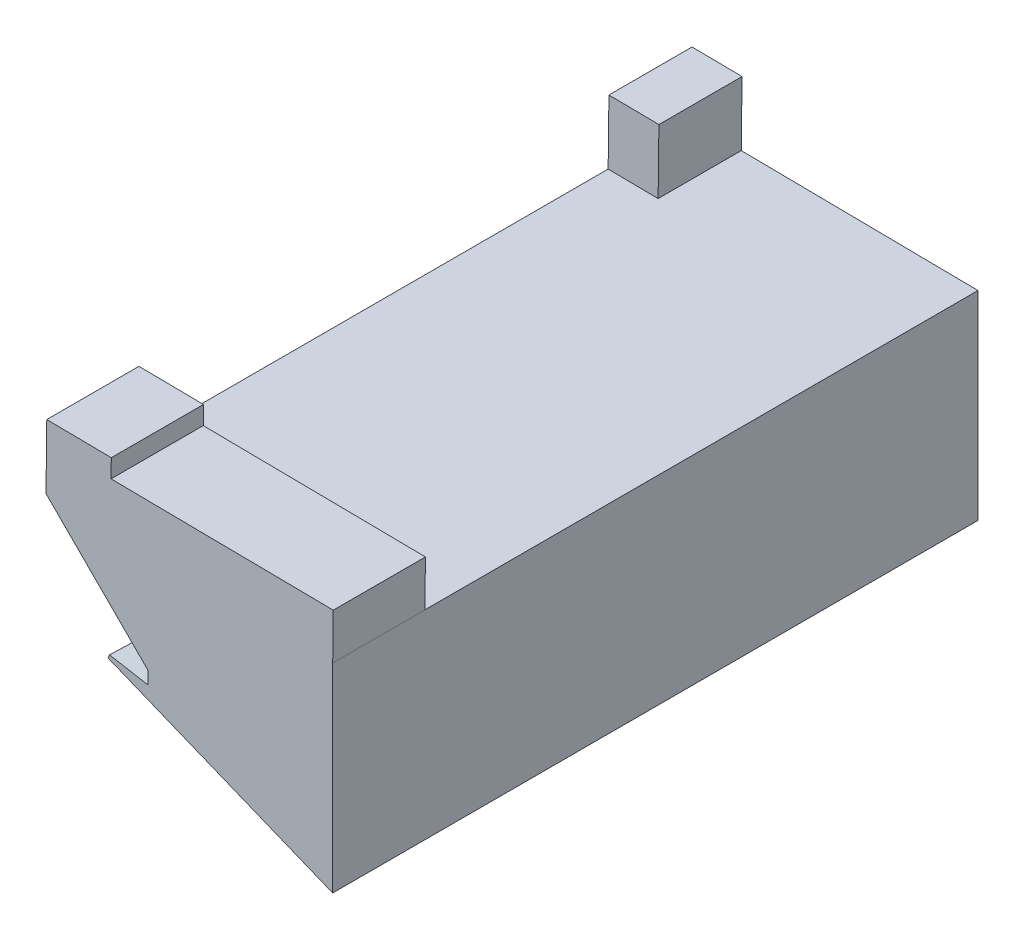
from build123d import *

# Parameters (mm, degrees)
BOSS_EXTRU_1_DEPTH      = 35
ESQUISSE3_W             = 15.551416147
ESQUISSE3_H             = 5
BOSS_EXTRU_3_DEPTH      = 3.5
ESQUISSE4_W             = 14.990100516
ESQUISSE4_H             = 8.543070591
ENL_V_MAT_EXTRU_4_DEPTH = 11
ESQUISSE5_W             = 2.711143337
ESQUISSE5_H             = 4.509933932
BOSS_EXTRU_4_DEPTH      = 3.5
CONG_2_R                = 0.1
ENL_V_MAT_EXTRU_7_DEPTH = 11


with BuildPart() as part:
    # Esquisse1 → Boss.-Extru.1 (new body)
    with BuildSketch(Plane.XY):
        Polygon((0, -0.638190255), (-5.531744574, 4.893554319), (10.018583778, 4.709618574), (10.016881657, -6.092719993), (-3.032142088, -0.792171418), (0, -1.326819878), align=None)
    extrude(amount=BOSS_EXTRU_1_DEPTH)

    # Esquisse3 → Boss.-Extru.3 (add)
    with BuildSketch(Plane(origin=(0.05710105, 4.827447131, 0), x_dir=(0.9999300516333419, -0.011827588111794733, 0), z_dir=(0.011827588111794733, 0.9999300516333419, 0))):
        with Locations((2.186471492, -32.5)):
            Rectangle(ESQUISSE3_W, ESQUISSE3_H)
    extrude(amount=BOSS_EXTRU_3_DEPTH)

    # Esquisse4 → Enlèv. mat.-Extru.4 (cut)
    with BuildSketch(Plane(origin=(0.21677349, 18.326502828, 0), x_dir=(0.9999300516333419, -0.011827588111794735, 0), z_dir=(0.011827588111794735, 0.9999300516333419, 0))):
        with Locations((5.405813676, -32.865617066)):
            Rectangle(ESQUISSE4_W, ESQUISSE4_H)
    extrude(amount=-ENL_V_MAT_EXTRU_4_DEPTH, mode=Mode.SUBTRACT)

    # Esquisse5 → Boss.-Extru.4 (add)
    with BuildSketch(Plane(origin=(0.05710105, 4.827447131, 0), x_dir=(0.9999300516333419, -0.011827588111794733, 0), z_dir=(0.011827588111794733, 0.9999300516333419, 0))):
        with Locations((-4.233664914, -2.254966966)):
            Rectangle(ESQUISSE5_W, ESQUISSE5_H)
    extrude(amount=BOSS_EXTRU_4_DEPTH)

    # Congé2
    cong_2_edges = [part.edges().sort_by_distance(p)[0] for p in [
        (-3.032142088, -0.792171418, 17.5),
    ]]
    fillet(cong_2_edges, radius=CONG_2_R)

    # Esquisse6 → Enlèv. mat.-Extru.7 (cut)
    with BuildSketch(Plane(origin=(-4.469048391, -11.002015687, 0), x_dir=(-0.9264818598701292, 0.37633942569386236, 0), z_dir=(-0.37633942569386236, -0.9264818598701292, 0))):
        Polygon((1.67530136, 0.492691421), (1.67530136, -38.461342547), (0.532077108, 0.492691421), align=None)
    extrude(amount=-ENL_V_MAT_EXTRU_7_DEPTH, mode=Mode.SUBTRACT)


solid = part.part
